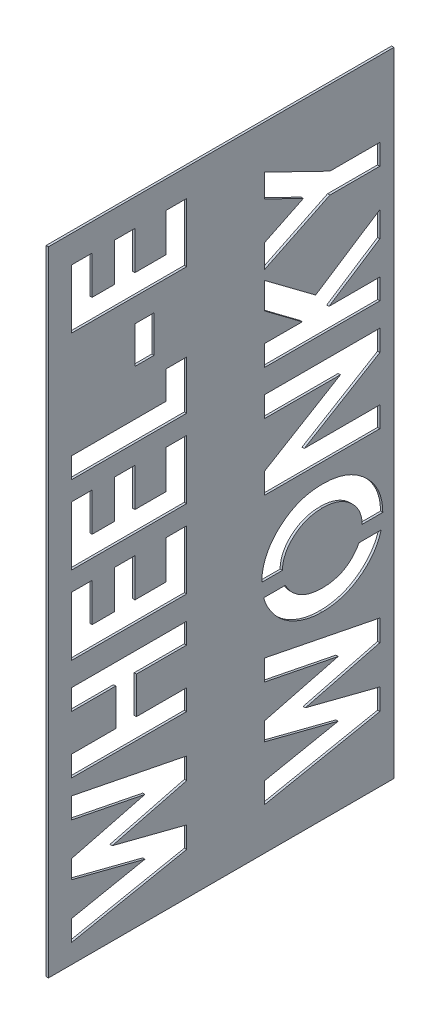
from build123d import *

# Parameters (mm, degrees)
SKETCH2_W           = 110
SKETCH2_H           = 60
BOSS_EXTRUDE1_DEPTH = 0.4
SKETCH1_W           = 6.41025641
SKETCH1_H           = 3.333333333
CUT_EXTRUDE1_DEPTH  = 1.5
SKETCH3_W           = 2.5
SKETCH3_H           = 22
BOSS_EXTRUDE2_DEPTH = 0.4


with BuildPart() as part:
    # Sketch2 → Boss-Extrude1 (new body)
    with BuildSketch(Plane.YZ):
        with Locations((0, -6)):
            Rectangle(SKETCH2_W, SKETCH2_H)
    extrude(amount=BOSS_EXTRUDE1_DEPTH)

    # Sketch1 → Cut-Extrude1 (cut)
    # profile 1 of 12: a face of its own
    with BuildSketch(Plane.YZ):
        Polygon((-51.666666667, 20), (-48.064903846, 20), (-45.512820513, 7.231570513), (-42.223557692, 20), (-39.046474359, 20), (-35.769230769, 7.231570513), (-33.229166667, 20), (-29.615384615, 20), (-33.59775641, 0), (-37.323717949, 0), (-40.641025641, 12.928685897), (-43.970352564, 0), (-47.672275641, 0), align=None)
    # profile 2 of 12: a face of its own
    with BuildSketch(Plane.YZ):
        Polygon((-26.923076923, 20), (-23.333333333, 20), (-23.333333333, 12.307692308), (-16.923076923, 12.307692308), (-16.923076923, 20), (-13.333333333, 20), (-13.333333333, 0), (-16.923076923, 0), (-16.923076923, 8.717948718), (-23.333333333, 8.717948718), (-23.333333333, 0), (-26.923076923, 0), align=None)
    # profile 3 of 12: a face of its own
    with BuildSketch(Plane.YZ):
        Polygon((-9.230769231, 20), (1.025641026, 20), (1.025641026, 16.41025641), (-5.641025641, 16.41025641), (-5.641025641, 12.564102564), (1.025641026, 12.564102564), (1.025641026, 8.974358974), (-5.641025641, 8.974358974), (-5.641025641, 3.58974359), (1.025641026, 3.58974359), (1.025641026, 0), (-9.230769231, 0), align=None)
    # profile 4 of 12: a face of its own
    with BuildSketch(Plane.YZ):
        Polygon((4.358974359, 20), (14.615384615, 20), (14.615384615, 16.41025641), (7.948717949, 16.41025641), (7.948717949, 12.564102564), (14.615384615, 12.564102564), (14.615384615, 8.974358974), (7.948717949, 8.974358974), (7.948717949, 3.58974359), (14.615384615, 3.58974359), (14.615384615, 0), (4.358974359, 0), align=None)
    # profile 5 of 12: a face of its own
    with BuildSketch(Plane.YZ):
        Polygon((17.948717949, 20), (21.538461538, 20), (21.538461538, 3.58974359), (26.41025641, 3.58974359), (26.41025641, 0), (17.948717949, 0), align=None)
    # profile 6 of 12: a face of its own
    with BuildSketch(Plane.YZ):
        with Locations((32.692307692, 7.307692308)):
            Rectangle(SKETCH1_W, SKETCH1_H)
    # profile 7 of 12: a face of its own
    with BuildSketch(Plane.YZ):
        Polygon((40, 20), (50.256410256, 20), (50.256410256, 16.41025641), (43.58974359, 16.41025641), (43.58974359, 12.564102564), (50.256410256, 12.564102564), (50.256410256, 8.974358974), (43.58974359, 8.974358974), (43.58974359, 3.58974359), (50.256410256, 3.58974359), (50.256410256, 0), (40, 0), align=None)
    # profile 8 of 12: a face of its own
    with BuildSketch(Plane.YZ):
        Polygon((-47.692307692, -13.564102564), (-44.090544872, -13.564102564), (-41.538461538, -26.332532051), (-38.249198718, -13.564102564), (-35.072115385, -13.564102564), (-31.794871795, -26.332532051), (-29.254807692, -13.564102564), (-25.641025641, -13.564102564), (-29.623397436, -33.564102564), (-33.349358974, -33.564102564), (-36.666666667, -20.635416667), (-39.99599359, -33.564102564), (-43.697916667, -33.564102564), align=None)
    # profile 9 of 12: a face of its own
    with BuildSketch(Plane.YZ):
        with BuildLine():
            add(Edge.make_bspline(
                [(-14.06650641, -13.051282051), (-13.744096393, -13.060200752), (-13.107990808, -13.077797089), (-12.171792719, -13.227384658), (-11.270051972, -13.466863295), (-10.403258117, -13.80576993), (-9.572814564, -14.242828109), (-8.77633152, -14.774188073), (-8.016570157, -15.40509693), (-7.299023957, -16.119574589), (-6.640995903, -16.902529098), (-6.067108596, -17.740067835), (-5.57402641, -18.614893181), (-5.175997892, -19.535162334), (-4.866149068, -20.497259855), (-4.647650698, -21.502223975), (-4.511274378, -22.549400165), (-4.495302335, -23.261863607), (-4.487179487, -23.624198718)],
                knots=[0, 0, 0, 0, 0.975475121, 1.924584036, 2.862050404, 3.795192179, 4.73547842, 5.697482824, 6.688185339, 7.720127412, 8.758959249, 9.779371059, 10.78927852, 11.79413254, 12.809221242, 13.844041599, 14.903551563, 16, 16, 16, 16], degree=3))
            add(Edge.make_bspline(
                [(-4.487179487, -23.624198718), (-4.495879333, -23.982451632), (-4.513011477, -24.687940127), (-4.641428451, -25.725441791), (-4.86433504, -26.719501831), (-5.166861386, -27.673601872), (-5.564050698, -28.582806674), (-6.040024779, -29.454353465), (-6.615439043, -30.276356113), (-7.260954892, -31.053205339), (-7.974312486, -31.754618461), (-8.724922801, -32.38111125), (-9.522361334, -32.900582945), (-10.352072694, -33.335939792), (-11.221255578, -33.6682789), (-12.127610814, -33.906774579), (-13.071083583, -34.048834241), (-13.713462373, -34.067486385), (-14.038461538, -34.076923077)],
                knots=[0, 0, 0, 0, 1.091036058, 2.148519542, 3.177824611, 4.190200805, 5.192186639, 6.195302949, 7.209671048, 8.243467137, 9.267421614, 10.252798453, 11.216262933, 12.160481942, 13.101717351, 14.043936636, 15.01036745, 16, 16, 16, 16], degree=3))
            add(Edge.make_bspline(
                [(-14.038461538, -34.076923077), (-14.378276177, -34.068468587), (-15.047890858, -34.051808768), (-16.027319977, -33.896806674), (-16.967213241, -33.660137389), (-17.85768697, -33.311488892), (-18.707849296, -32.871846846), (-19.511309878, -32.332572624), (-20.267958915, -31.692451481), (-20.975118619, -30.969423882), (-21.613496066, -30.176550426), (-22.180183132, -29.341468167), (-22.651649192, -28.464351886), (-23.045719913, -27.554385578), (-23.34395346, -26.605642656), (-23.562375953, -25.622187668), (-23.692273591, -24.601239826), (-23.709311349, -23.90768866), (-23.717948718, -23.556089744)],
                knots=[0, 0, 0, 0, 1.023898092, 2.017621128, 2.982528455, 3.94116461, 4.893871288, 5.863237963, 6.852078694, 7.877147914, 8.907848342, 9.917426368, 10.915569355, 11.905860113, 12.902971091, 13.909235377, 14.940077371, 16, 16, 16, 16], degree=3))
            add(Edge.make_bspline(
                [(-23.717948718, -23.556089744), (-23.714146816, -23.319583687), (-23.706595084, -22.849810886), (-23.644692348, -22.152786403), (-23.545331162, -21.470353918), (-23.404216825, -20.802797161), (-23.224540504, -20.149537192), (-23.002738347, -19.51027941), (-22.742878599, -18.884934207), (-22.441820164, -18.276783586), (-22.108409017, -17.691431258), (-21.741226731, -17.135075517), (-21.345168666, -16.60932524), (-20.91570437, -16.116314781), (-20.456531224, -15.655022946), (-19.973378311, -15.219315968), (-19.452665247, -14.824263251), (-18.909893573, -14.455196819), (-18.345799847, -14.124231361), (-17.764636181, -13.839903592), (-17.176436751, -13.591885074), (-16.573168211, -13.398988763), (-15.963034481, -13.237944005), (-15.33922683, -13.133958575), (-14.706622245, -13.06042288), (-14.28039776, -13.054336411), (-14.06650641, -13.051282051)],
                knots=[0, 0, 0, 0, 1.073962007, 2.133214465, 3.175381649, 4.204334277, 5.229938729, 6.250365144, 7.275377606, 8.303400285, 9.330277255, 10.332865311, 11.328771642, 12.317560558, 13.299686236, 14.283383796, 15.269639644, 16.265509037, 17.263094604, 18.236869618, 19.202164572, 20.159250289, 21.111017109, 22.065273625, 23.029100275, 24, 24, 24, 24], degree=3))
        make_face()
        with BuildLine():
            add(Edge.make_bspline(
                [(-14.114583333, -16.641025641), (-14.323288685, -16.647170917), (-14.73343064, -16.659247441), (-15.334877995, -16.755071434), (-15.911313557, -16.904748776), (-16.460608774, -17.125879094), (-16.986927512, -17.401659613), (-17.487897686, -17.742009653), (-17.960874272, -18.144591441), (-18.40331538, -18.603861879), (-18.805293545, -19.109924209), (-19.16077533, -19.653804302), (-19.460658876, -20.231093465), (-19.707969292, -20.840958506), (-19.894850231, -21.485868847), (-20.030745827, -22.162517924), (-20.111961993, -22.873027821), (-20.122711624, -23.356892097), (-20.128205128, -23.604166667)],
                knots=[0, 0, 0, 0, 0.974894191, 1.915834964, 2.839288839, 3.752542006, 4.676607294, 5.611359648, 6.576697791, 7.574223331, 8.586940095, 9.592690423, 10.60600318, 11.622405634, 12.663176809, 13.739059825, 14.844566471, 16, 16, 16, 16], degree=3))
            add(Edge.make_bspline(
                [(-20.128205128, -23.604166667), (-20.120758642, -23.878204669), (-20.106177811, -24.414793595), (-20.007570168, -25.19793047), (-19.833156963, -25.935197452), (-19.597649316, -26.631110084), (-19.288897006, -27.282361415), (-18.907637653, -27.885758048), (-18.467269743, -28.451802377), (-18.120111919, -28.7819247), (-17.944711538, -28.948717949)],
                knots=[0, 0, 0, 0, 1.104487002, 2.162676302, 3.174511073, 4.153263563, 5.118723809, 6.07154278, 7.025653154, 8, 8, 8, 8], degree=3))
            add(Edge.make_bspline(
                [(-17.944711538, -28.948717949), (-17.802457388, -29.071367468), (-17.522926978, -29.312374638), (-17.074391398, -29.627601998), (-16.609389781, -29.89134794), (-16.128879206, -30.111155391), (-15.631730019, -30.278514453), (-15.119493518, -30.399331957), (-14.592200146, -30.473726385), (-14.235017318, -30.482662783), (-14.054487179, -30.487179487)],
                knots=[0, 0, 0, 0, 1.051915698, 2.067021768, 3.065640842, 4.043439198, 5.023039528, 5.99946272, 6.988872803, 8, 8, 8, 8], degree=3))
            add(Edge.make_bspline(
                [(-14.054487179, -30.487179487), (-13.851179003, -30.480738285), (-13.449133352, -30.468000689), (-12.858478582, -30.375308856), (-12.292415399, -30.216237085), (-11.748038398, -30.000497884), (-11.227745468, -29.715950501), (-10.730307249, -29.371332585), (-10.259848334, -28.960984577), (-9.813617058, -28.500609901), (-9.407750016, -27.990278415), (-9.051398705, -27.445572712), (-8.746856956, -26.872577176), (-8.504067662, -26.268619852), (-8.309226955, -25.636583336), (-8.175120534, -24.974977556), (-8.09313999, -24.284652058), (-8.082399757, -23.815402459), (-8.076923077, -23.576121795)],
                knots=[0, 0, 0, 0, 0.959608293, 1.897643009, 2.81387818, 3.73054705, 4.655847239, 5.607219112, 6.581665152, 7.598233058, 8.630090891, 9.654778461, 10.667213044, 11.688092221, 12.723123026, 13.785218522, 14.870634339, 16, 16, 16, 16], degree=3))
            add(Edge.make_bspline(
                [(-8.076923077, -23.576121795), (-8.082600959, -23.338211291), (-8.093766374, -22.870366108), (-8.173241219, -22.181935915), (-8.315119467, -21.523002259), (-8.507789401, -20.891624651), (-8.75113974, -20.285743288), (-9.059071298, -19.712579299), (-9.416298975, -19.164006761), (-9.827144555, -18.651701301), (-10.274388993, -18.183131164), (-10.750662661, -17.769387778), (-11.250569644, -17.419583878), (-11.778099663, -17.135591665), (-12.328370761, -16.916129153), (-12.902043151, -16.751901042), (-13.501322914, -16.660481536), (-13.90863045, -16.647559566), (-14.114583333, -16.641025641)],
                knots=[0, 0, 0, 0, 1.11638023, 2.195334398, 3.246259949, 4.275129056, 5.28993078, 6.304809905, 7.323397351, 8.357919574, 9.381814202, 10.359298466, 11.31372916, 12.239033967, 13.164211429, 14.088751906, 15.033587594, 16, 16, 16, 16], degree=3))
        make_face(mode=Mode.SUBTRACT)
    # profile 10 of 12: a face of its own
    with BuildSketch(Plane.YZ):
        Polygon((-1.153846154, -13.564102564), (2.487980769, -13.564102564), (10.384615385, -26.725160256), (10.384615385, -13.564102564), (13.974358974, -13.564102564), (13.974358974, -33.564102564), (10.304487179, -33.564102564), (2.435897436, -20.443108974), (2.435897436, -33.564102564), (-1.153846154, -33.564102564), align=None)
    # profile 11 of 12: a face of its own
    with BuildSketch(Plane.YZ):
        Polygon((18.076923077, -13.564102564), (21.666666667, -13.564102564), (21.666666667, -20.094551282), (26.5625, -13.564102564), (31.149839744, -13.564102564), (24.52724359, -22.41025641), (31.794871795, -33.564102564), (27.423878205, -33.564102564), (21.666666667, -24.729967949), (21.666666667, -33.564102564), (18.076923077, -33.564102564), align=None)
    # profile 12 of 12: a face of its own
    with BuildSketch(Plane.YZ):
        Polygon((32.820512821, -13.564102564), (36.862980769, -13.564102564), (40.128205128, -20.282852564), (43.401442308, -13.564102564), (47.435897436, -13.564102564), (41.923076923, -24.90224359), (41.923076923, -33.564102564), (38.333333333, -33.564102564), (38.333333333, -24.90224359), align=None)
    extrude(amount=CUT_EXTRUDE1_DEPTH, mode=Mode.SUBTRACT)


with BuildPart() as cut_extrude1_piece_1:
    # of the separate pieces the step leaves, piece 1, a body of its own (cut_extrude1_pieces)
    add(part.part.solids().sort_by_distance((0, -55, 24))[0])



with BuildPart() as cut_extrude1_piece_2:
    # of the separate pieces the step leaves, piece 2, a body of its own (cut_extrude1_pieces)
    add(part.part.solids().sort_by_distance((0, -14.114583333, -16.641025641))[0])


with BuildPart() as cut_extrude1_piece_1_1:
    add(cut_extrude1_piece_1.part)

    add(cut_extrude1_piece_2.part)  # Boss-Extrude2 merges Cut-Extrude1 piece 2
    # Sketch3 → Boss-Extrude2 (add)
    with BuildSketch(Plane.YZ.offset(0.4)):
        with Locations((-15.25, -24)):
            Rectangle(SKETCH3_W, SKETCH3_H)
    extrude(amount=-BOSS_EXTRUDE2_DEPTH)


solid = cut_extrude1_piece_1_1.part
